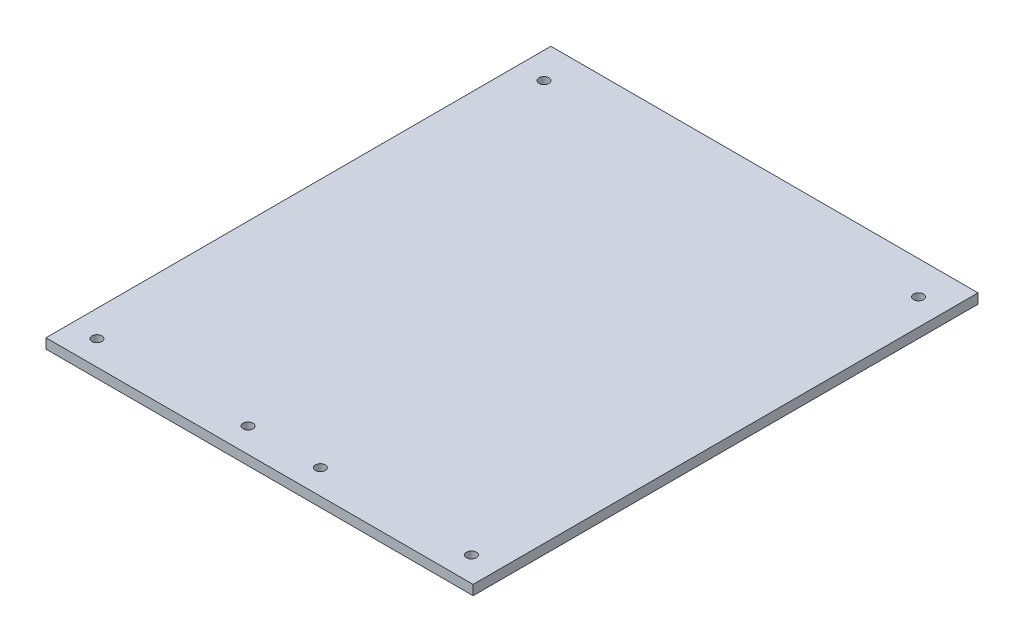
from build123d import *

# Parameters (mm, degrees)
SKETCH2_W           = 130
SKETCH2_H           = 153.666
SKETCH2_R           = 1.5
BOSS_EXTRUDE1_DEPTH = 3


with BuildPart() as part:
    # Sketch2 → Boss-Extrude1 (new body)
    with BuildSketch(Plane(origin=(0, 0, 0), x_dir=(1, 0, 0), z_dir=(0, 1, 0))):
        with Locations((65, 76.833)):
            Rectangle(SKETCH2_W, SKETCH2_H)
        with Locations(Location((8, 143.566, 0), (0, 0, 270))):
            Circle(SKETCH2_R, mode=Mode.SUBTRACT)
        with Locations(Location((8, 7.5, 0), (0, 0, 270))):
            Circle(SKETCH2_R, mode=Mode.SUBTRACT)
        with Locations(Location((54, 7.5, 0), (0, 0, 270))):
            Circle(SKETCH2_R, mode=Mode.SUBTRACT)
        with Locations(Location((122, 7.5, 0), (0, 0, 90))):
            Circle(SKETCH2_R, mode=Mode.SUBTRACT)
        with Locations(Location((76, 7.5, 0), (0, 0, 90))):
            Circle(SKETCH2_R, mode=Mode.SUBTRACT)
        with Locations(Location((122, 143.566, 0), (0, 0, 90))):
            Circle(SKETCH2_R, mode=Mode.SUBTRACT)
    extrude(amount=BOSS_EXTRUDE1_DEPTH)


solid = part.part
